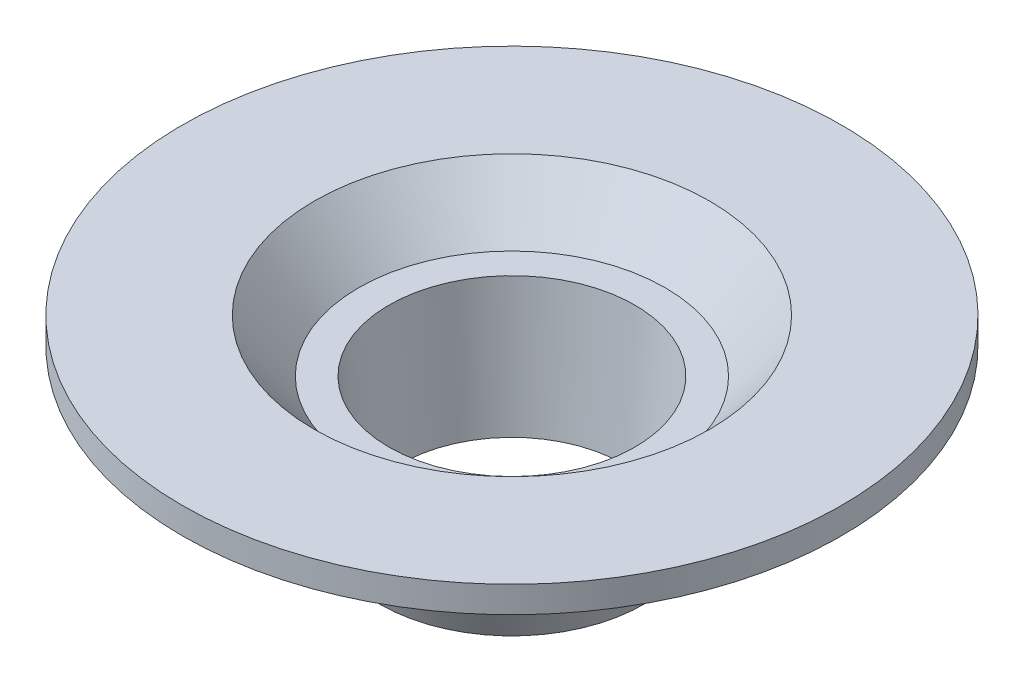
from build123d import *


with BuildPart() as part:
    # Sketch2 → Revolve1 (revolve)
    with BuildSketch(Plane.XY, mode=Mode.PRIVATE) as revolve1_sk:
        Polygon((4.226060171, 0), (5, 0), (6.558293189, 4), (8.5, 4), (10.430680086, 6), (12.5, 6), (12.5, 7), (7.5, 7), (5.810218447, 5), (4.666104137, 5), align=None)
    revolve(revolve1_sk.sketch.rotate(Axis((0, 14.449053436, 0), (0, -1, 0)), 90), axis=Axis((0, 14.449053436, 0), (0, -1, 0)))


solid = part.part
